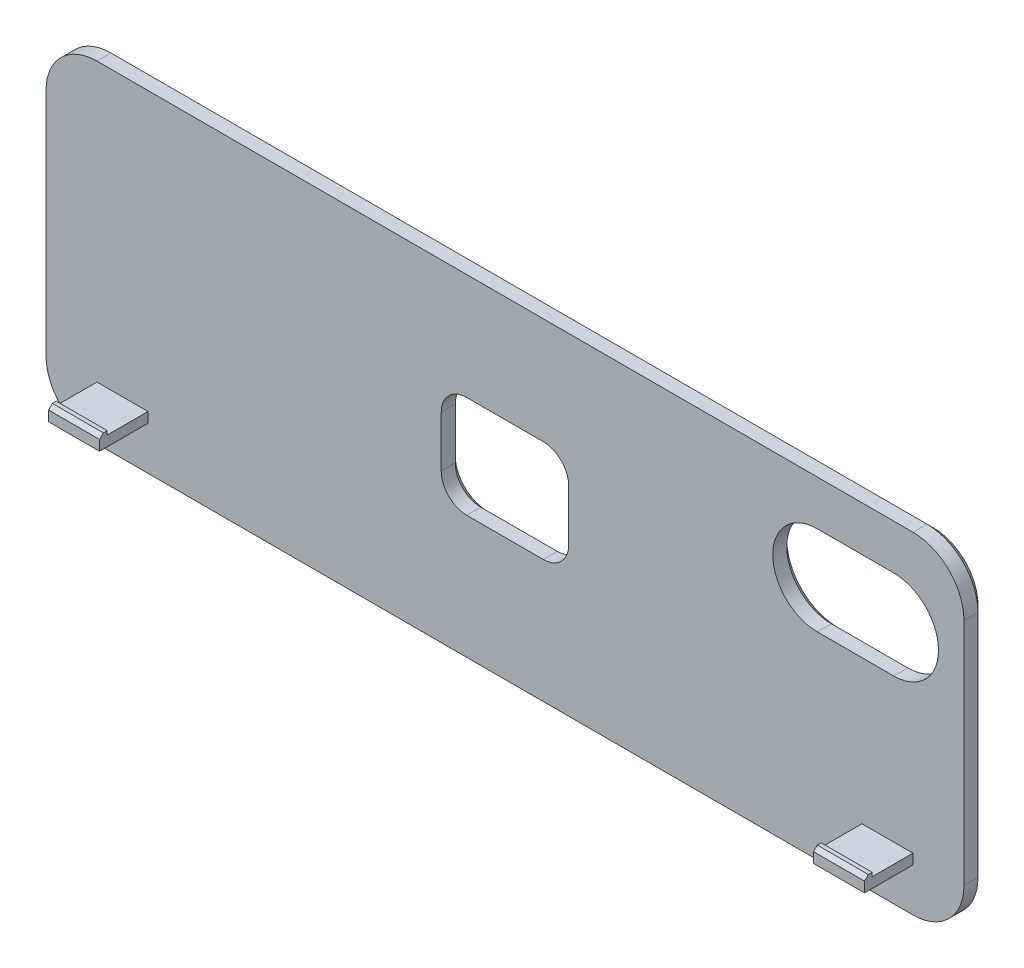
from build123d import *

# Parameters (mm, degrees)
BOSS_EXTRUDE1_START = -80
BOSS_EXTRUDE1_DEPTH = 1.6
CHAMFER1_SIZE       = 0.5
BOSS_EXTRUDE2_START = -81
BOSS_EXTRUDE2_DEPTH = 3
CHAMFER2_SIZE       = 0.5
BOSS_EXTRUDE3_START = -81
BOSS_EXTRUDE3_DEPTH = 3
CHAMFER3_SIZE       = 0.5
BOSS_EXTRUDE4_START = -80.1
SKETCH4_W           = 3
SKETCH4_H           = 0.9
BOSS_EXTRUDE4_DEPTH = 0.9
BOSS_EXTRUDE5_START = -32
BOSS_EXTRUDE5_DEPTH = 4
BOSS_EXTRUDE6_START = 28
BOSS_EXTRUDE6_DEPTH = 4


with BuildPart() as part:
    # Sketch1 → Boss-Extrude1 (new body)
    with BuildSketch(Plane.XY.offset(BOSS_EXTRUDE1_START)):
        with BuildLine():
            Line((-32, 8.6), (32, 8.6))
            ThreePointArc((32, 8.6), (34.828427125, 9.771572875), (36, 12.6))
            Line((36, 12.6), (36, 30.6))
            ThreePointArc((36, 30.6), (34.828427125, 33.428427125), (32, 34.6))
            Line((32, 34.6), (-32, 34.6))
            ThreePointArc((-32, 34.6), (-34.828427125, 33.428427125), (-36, 30.6))
            Line((-36, 30.6), (-36, 12.6))
            ThreePointArc((-36, 12.6), (-34.828427125, 9.771572875), (-32, 8.6))
        make_face()
    extrude(amount=BOSS_EXTRUDE1_DEPTH)

    # Chamfer1
    chamfer1_edges = [part.edges().sort_by_distance(p)[0] for p in [
        (36, 21.6, -80),
        (34.828427125, 9.771572875, -80),
        (0, 8.6, -80),
        (-34.828427125, 9.771572875, -80),
        (-36, 21.6, -80),
        (-34.828427125, 33.428427125, -80),
        (0, 34.6, -80),
        (34.828427125, 33.428427125, -80),
    ]]
    chamfer(chamfer1_edges, length=CHAMFER1_SIZE)


with BuildPart() as body_2:
    # Sketch2 → Boss-Extrude2 (new body)
    with BuildSketch(Plane.XY.offset(BOSS_EXTRUDE2_START)):
        with BuildLine():
            Line((-3, 18.25), (3, 18.25))
            ThreePointArc((3, 18.25), (4.414213562, 18.835786438), (5, 20.25))
            Line((5, 20.25), (5, 24.25))
            ThreePointArc((5, 24.25), (4.414213562, 25.664213562), (3, 26.25))
            Line((3, 26.25), (-3, 26.25))
            ThreePointArc((-3, 26.25), (-4.414213562, 25.664213562), (-5, 24.25))
            Line((-5, 24.25), (-5, 20.25))
            ThreePointArc((-5, 20.25), (-4.414213562, 18.835786438), (-3, 18.25))
        make_face()
    extrude(amount=BOSS_EXTRUDE2_DEPTH)


with BuildPart() as part_1:
    add(part.part)

    # Combine1: cut body 2
    add(body_2.part, mode=Mode.SUBTRACT)

    # Chamfer2
    chamfer2_edges = [part_1.edges().sort_by_distance(p)[0] for p in [
        (-5, 22.25, -80),
        (-4.414213562, 25.664213562, -80),
        (0, 26.25, -80),
        (4.414213562, 25.664213562, -80),
        (5, 22.25, -80),
        (4.414213562, 18.835786438, -80),
        (0, 18.25, -80),
        (-4.414213562, 18.835786438, -80),
    ]]
    chamfer(chamfer2_edges, length=CHAMFER2_SIZE)


with BuildPart() as body_2_2:
    # Sketch3 → Boss-Extrude3 (new body)
    with BuildSketch(Plane.XY.offset(BOSS_EXTRUDE3_START)):
        with BuildLine():
            Line((24.5, 24.08), (30.5, 24.08))
            ThreePointArc((30.5, 24.08), (32.974873734, 25.105126266), (34, 27.58))
            ThreePointArc((34, 27.58), (32.974873734, 30.054873734), (30.5, 31.08))
            Line((30.5, 31.08), (24.5, 31.08))
            ThreePointArc((24.5, 31.08), (22.025126266, 30.054873734), (21, 27.58))
            ThreePointArc((21, 27.58), (22.025126266, 25.105126266), (24.5, 24.08))
        make_face()
    extrude(amount=BOSS_EXTRUDE3_DEPTH)


with BuildPart() as part_2:
    add(part_1.part)

    # Combine2: cut body 2 2
    add(body_2_2.part, mode=Mode.SUBTRACT)

    # Chamfer3
    chamfer3_edges = [part_2.edges().sort_by_distance(p)[0] for p in [
        (27.5, 31.08, -80),
        (34, 27.58, -80),
        (27.5, 24.08, -80),
        (21, 27.58, -80),
    ]]
    chamfer(chamfer3_edges, length=CHAMFER3_SIZE)


with BuildPart() as body_2_3:
    # Sketch4 → Boss-Extrude4 (new body)
    with BuildSketch(Plane.XY.offset(BOSS_EXTRUDE4_START)):
        with Locations((0, 8.95)):
            Rectangle(SKETCH4_W, SKETCH4_H)
    extrude(amount=BOSS_EXTRUDE4_DEPTH)


with BuildPart() as part_3:
    add(part_2.part)

    # Combine3: cut body 2 3
    add(body_2_3.part, mode=Mode.SUBTRACT)

    # Sketch5 → Boss-Extrude5 (add)
    with BuildSketch(Plane(origin=(0, 0, 0), x_dir=(0, 0, -1), z_dir=(1, 0, 0)).offset(BOSS_EXTRUDE5_START)):
        Polygon((78.41, 12), (74.6, 12), (74.6, 12.8), (74.9, 13.1), (75.2, 13.1), (75.2, 12.8), (78.41, 12.8), align=None)
    extrude(amount=BOSS_EXTRUDE5_DEPTH)

    # Sketch6 → Boss-Extrude6 (add)
    with BuildSketch(Plane(origin=(0, 0, 0), x_dir=(0, 0, -1), z_dir=(1, 0, 0)).offset(BOSS_EXTRUDE6_START)):
        Polygon((78.41, 12), (74.6, 12), (74.6, 12.8), (74.9, 13.1), (75.2, 13.1), (75.2, 12.8), (78.41, 12.8), align=None)
    extrude(amount=BOSS_EXTRUDE6_DEPTH)


solid = part_3.part
